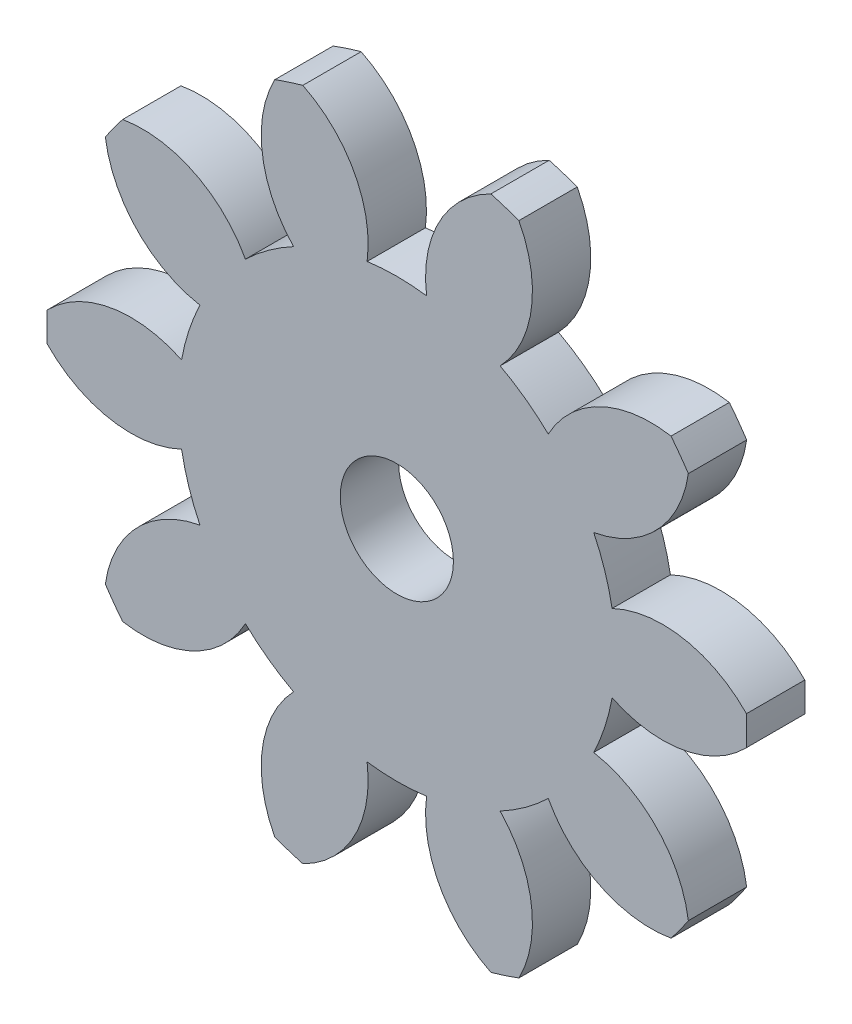
from build123d import *

# Parameters (mm, degrees)
SKETCH1_R           = 18
BOSS_EXTRUDE1_DEPTH = 3
CUT_EXTRUDE1_START  = -3
CUT_EXTRUDE1_DEPTH  = 3
CIRPATTERN1_COUNT   = 10
CUT_EXTRUDE3_DEPTH  = 26.171545449


with BuildPart() as part:
    # Sketch1 → Boss-Extrude1 (new body)
    with BuildSketch(Plane.XY):
        Circle(SKETCH1_R)
    extrude(amount=BOSS_EXTRUDE1_DEPTH)

    # Sketch2 → Cut-Extrude1 (cut)
    with BuildSketch(Plane.XY.offset(3).offset(CUT_EXTRUDE1_START)):
        with BuildLine():
            ThreePointArc((4.836662041, 17.338013159), (2.183107171, 14.775836074), (1.52990268, 11.145487777))
            ThreePointArc((1.52990268, 11.145487777), (0, 11.25), (-1.52990268, 11.145487777))
            ThreePointArc((-1.52990268, 11.145487777), (-2.183107171, 14.775836074), (-4.836662041, 17.338013159))
            ThreePointArc((-4.836662041, 17.338013159), (0, 18), (4.836662041, 17.338013159))
        make_face()
    cut_extrude1 = extrude(amount=CUT_EXTRUDE1_DEPTH, mode=Mode.SUBTRACT)

    # CirPattern1: Cut-Extrude1 ×10 about axis
    cirpattern1_axis = Axis((0, 0, 0), (0, 0, 1))
    for i in range(1, CIRPATTERN1_COUNT):
        add(cut_extrude1.rotate(cirpattern1_axis, i * 360 / CIRPATTERN1_COUNT), mode=Mode.SUBTRACT)

    # Sketch4 → Cut-Extrude3 (cut, through all)
    with BuildSketch(Plane.XY.offset(3)):
        with BuildLine():
            Line((-0.241039416, 2.9), (0.241039416, 2.9))
            ThreePointArc((0.241039416, 2.9), (0, -2.91), (-0.241039416, 2.9))
        make_face()
    extrude(amount=-CUT_EXTRUDE3_DEPTH, mode=Mode.SUBTRACT)


solid = part.part
